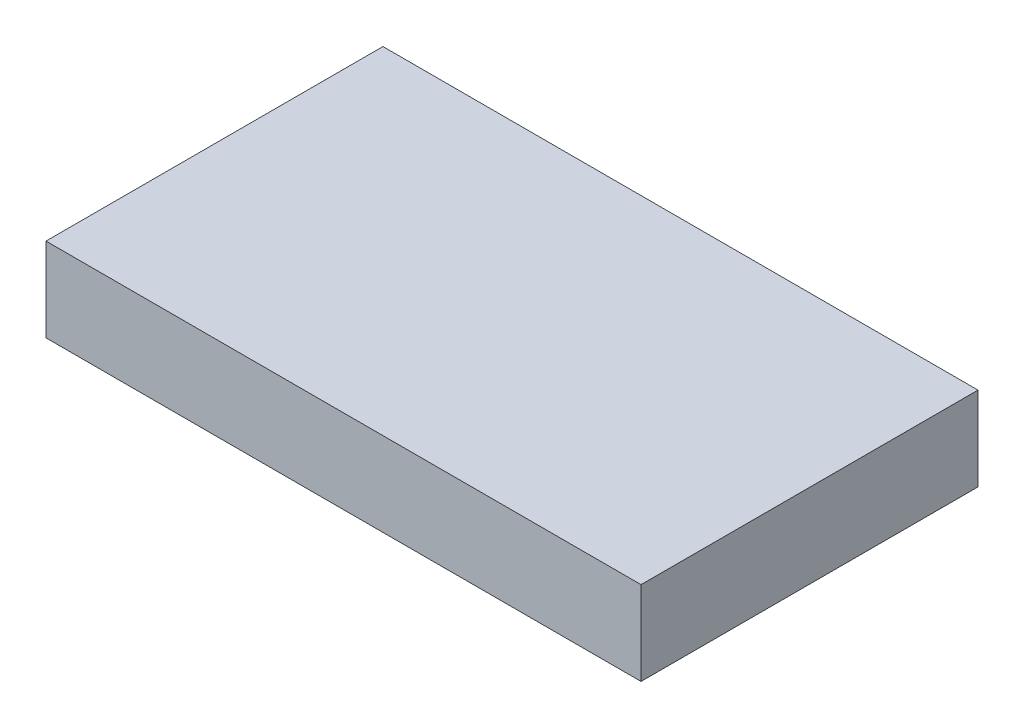
from build123d import *

# Parameters (mm, degrees)
SKETCH1_W           = 74.65
SKETCH1_H           = 42.27
BOSS_EXTRUDE1_DEPTH = 10.52


with BuildPart() as part:
    # Sketch1 → Boss-Extrude1 (new body)
    with BuildSketch(Plane(origin=(0, 0, 0), x_dir=(1, 0, 0), z_dir=(0, 1, 0))):
        Rectangle(SKETCH1_W, SKETCH1_H)
    extrude(amount=BOSS_EXTRUDE1_DEPTH)


solid = part.part
